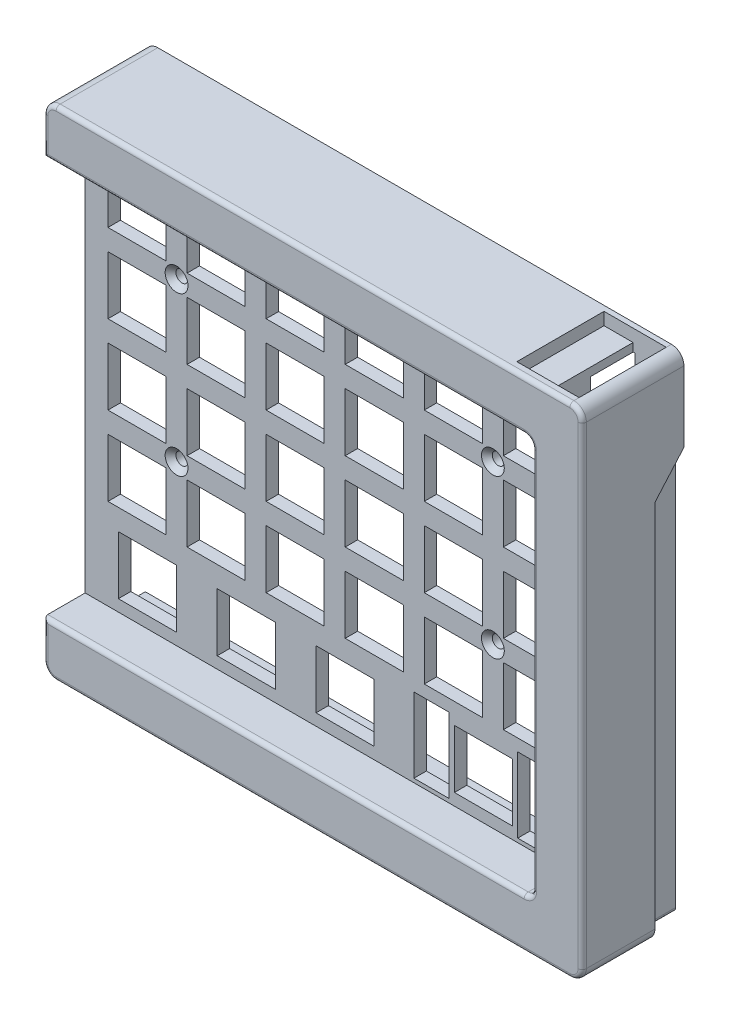
from build123d import *

# Parameters (mm, degrees)
MAIN_EXTRUSION_DEPTH                                 = 24.5
FRONT_CAVE_DEPTH                                     = 10
SKETCH2_W                                            = 14
SKETCH2_H                                            = 14
SKETCH2_W_2                                          = 8.5
SKETCH2_H_2                                          = 18
KEY_CUTOUTS_DEPTH                                    = 3
CUT_EXTRUDE1_DEPTH                                   = 11.5
CSK_FOR_M2_5_COUNTERSUNK_FLAT_HEAD_SCREW_D           = 2.9
CSK_FOR_M2_5_COUNTERSUNK_FLAT_HEAD_SCREW_CSINK_D     = 5.5
CSK_FOR_M2_5_COUNTERSUNK_FLAT_HEAD_SCREW_CSINK_ANGLE = 90
CUT_EXTRUDE2_DEPTH                                   = 2
CUT_EXTRUDE3_DEPTH                                   = 2
FILLET1_R                                            = 1
SKETCH9_W                                            = 8
SKETCH9_H                                            = 21
CUT_EXTRUDE4_DEPTH                                   = 41
SKETCH10_W                                           = 6
SKETCH10_H                                           = 10
CUT_EXTRUDE5_DEPTH                                   = 10.75
CUT_EXTRUDE6_DEPTH                                   = 1.5
SKETCH13_W                                           = 3.2
SKETCH13_H                                           = 60
CUT_EXTRUDE8_DEPTH                                   = 7
SKETCH15_W                                           = 7
SKETCH15_H                                           = 21
CUT_EXTRUDE9_DEPTH                                   = 3


with BuildPart() as part:
    # Sketch1 → Main Extrusion (new body)
    with BuildSketch(Plane.XY):
        with BuildLine():
            Line((-61.875, -60), (61.875, -60))
            ThreePointArc((61.875, -60), (63.996320344, -59.121320344), (64.875, -57))
            Line((64.875, -57), (64.875, 57))
            ThreePointArc((64.875, 57), (63.996320344, 59.121320344), (61.875, 60))
            Line((61.875, 60), (-61.875, 60))
            ThreePointArc((-61.875, 60), (-63.996320344, 59.121320344), (-64.875, 57))
            Line((-64.875, 57), (-64.875, -57))
            ThreePointArc((-64.875, -57), (-63.996320344, -59.121320344), (-61.875, -60))
        make_face()
    extrude(amount=MAIN_EXTRUSION_DEPTH)

    # Sketch3 → Front Cave (cut)
    with BuildSketch(Plane.XY.offset(24.5)):
        with BuildLine():
            Line((-64.875, 48), (50.875, 48))
            ThreePointArc((50.875, 48), (52.289213562, 47.414213562), (52.875, 46))
            Line((52.875, 46), (52.875, -46))
            ThreePointArc((52.875, -46), (52.289213562, -47.414213562), (50.875, -48))
            Line((50.875, -48), (-64.875, -48))
            Line((-64.875, -48), (-64.875, 48))
        make_face()
    extrude(amount=-FRONT_CAVE_DEPTH, mode=Mode.SUBTRACT)

    # Sketch2 → Key Cutouts (cut)
    with BuildSketch(Plane.XY.offset(14.5)):
        with Locations((-52.375, -0.1)):
            Rectangle(SKETCH2_W, SKETCH2_H)
        with Locations((-52.375, 38)):
            Rectangle(SKETCH2_W, SKETCH2_H)
        with Locations((-33.325, 38)):
            Rectangle(SKETCH2_W, SKETCH2_H)
        with Locations((-14.275, 38)):
            Rectangle(SKETCH2_W, SKETCH2_H)
        with Locations((4.775, 38)):
            Rectangle(SKETCH2_W, SKETCH2_H)
        with Locations((23.825, 38)):
            Rectangle(SKETCH2_W, SKETCH2_H)
        with Locations((42.875, 38)):
            Rectangle(SKETCH2_W, SKETCH2_H)
        with Locations((18.584400006, -38.05)):
            Rectangle(SKETCH2_W_2, SKETCH2_H_2)
        with Locations((-52.375, 18.95)):
            Rectangle(SKETCH2_W, SKETCH2_H)
        with Locations((-33.325, 18.95)):
            Rectangle(SKETCH2_W, SKETCH2_H)
        with Locations((-14.275, 18.95)):
            Rectangle(SKETCH2_W, SKETCH2_H)
        with Locations((4.775, 18.95)):
            Rectangle(SKETCH2_W, SKETCH2_H)
        with Locations((23.825, 18.95)):
            Rectangle(SKETCH2_W, SKETCH2_H)
        with Locations((42.875, 18.95)):
            Rectangle(SKETCH2_W, SKETCH2_H)
        with Locations((-33.325, -0.1)):
            Rectangle(SKETCH2_W, SKETCH2_H)
        with Locations((-14.275, -0.1)):
            Rectangle(SKETCH2_W, SKETCH2_H)
        with Locations((4.775, -0.1)):
            Rectangle(SKETCH2_W, SKETCH2_H)
        with Locations((23.825, -0.1)):
            Rectangle(SKETCH2_W, SKETCH2_H)
        with Locations((42.875, -0.1)):
            Rectangle(SKETCH2_W, SKETCH2_H)
        with Locations((-52.375, -19.15)):
            Rectangle(SKETCH2_W, SKETCH2_H)
        with Locations((-33.325, -19.15)):
            Rectangle(SKETCH2_W, SKETCH2_H)
        with Locations((-14.275, -19.15)):
            Rectangle(SKETCH2_W, SKETCH2_H)
        with Locations((4.775, -19.15)):
            Rectangle(SKETCH2_W, SKETCH2_H)
        with Locations((23.825, -19.15)):
            Rectangle(SKETCH2_W, SKETCH2_H)
        with Locations((42.875, -19.15)):
            Rectangle(SKETCH2_W, SKETCH2_H)
        with Locations((-26.063, -38.2)):
            Rectangle(SKETCH2_W, SKETCH2_H)
        with Locations((-49.875, -38.2)):
            Rectangle(SKETCH2_W, SKETCH2_H)
        with Locations((-2.251, -38.2)):
            Rectangle(SKETCH2_W, SKETCH2_H)
        with Locations((31.084, -38.15)):
            Rectangle(SKETCH2_W, SKETCH2_H)
        with Locations((43.583599994, -38.05)):
            Rectangle(SKETCH2_W_2, SKETCH2_H_2)
    extrude(amount=-KEY_CUTOUTS_DEPTH, mode=Mode.SUBTRACT)

    # Sketch4 → Cut-Extrude1 (cut)
    with BuildSketch(Plane.XY):
        Polygon((-64.875, 55), (54.375, 55), (54.375, 17.5), (59.875, 17.5), (59.875, -55), (-64.875, -55), align=None)
    extrude(amount=CUT_EXTRUDE1_DEPTH, mode=Mode.SUBTRACT)

    # CSK for M2.5 Countersunk Flat Head Screw1 (through all)
    with Locations(Plane(origin=(-42.85, 28.475, 14.5), x_dir=(1, 0, 0), z_dir=(0, 0, 1))):
        with Locations((0, 0), (76.2, 0), (76.2, -38.1), (0, -38.1)):
            CounterSinkHole(CSK_FOR_M2_5_COUNTERSUNK_FLAT_HEAD_SCREW_D / 2, CSK_FOR_M2_5_COUNTERSUNK_FLAT_HEAD_SCREW_CSINK_D / 2, counter_sink_angle=CSK_FOR_M2_5_COUNTERSUNK_FLAT_HEAD_SCREW_CSINK_ANGLE)

    # Sketch6 → Cut-Extrude2 (cut)
    with BuildSketch(Plane.XZ.offset(60)):
        Polygon((-44.875, 0), (-36.875, 7), (64.875, 7), (64.875, 0), align=None)
    extrude(amount=-CUT_EXTRUDE2_DEPTH, mode=Mode.SUBTRACT)

    # Sketch8 → Cut-Extrude3 (cut)
    with BuildSketch(Plane(origin=(64.875, 0, 0), x_dir=(0, 0, -1), z_dir=(1, 0, 0))):
        Polygon((0, -60), (-7, -60), (-7, 32), (0, 40), align=None)
    extrude(amount=-CUT_EXTRUDE3_DEPTH, mode=Mode.SUBTRACT)

    # Fillet1
    fillet1_edges = [part.edges().sort_by_distance(p)[0] for p in [
        (63.996320344, 59.121320344, 24.5),
        (0, 60, 24.5),
        (-63.996320344, 59.121320344, 24.5),
        (-64.875, 52.5, 24.5),
        (-64.875, -52.5, 24.5),
        (-63.996320344, -59.121320344, 24.5),
        (0, -60, 24.5),
        (-7, -48, 24.5),
        (52.289213562, -47.414213562, 24.5),
        (52.875, 0, 24.5),
        (52.289213562, 47.414213562, 24.5),
        (-7, 48, 24.5),
        (63.996320344, -59.121320344, 24.5),
        (62.875, -58, 3.5),
        (64.875, 0, 24.5),
    ]]
    fillet(fillet1_edges, radius=FILLET1_R)

    # Sketch9 → Cut-Extrude4 (cut)
    with BuildSketch(Plane(origin=(0, 60, 0), x_dir=(1, 0, 0), z_dir=(0, 1, 0))):
        with Locations((57.875, -11.75)):
            Rectangle(SKETCH9_W, SKETCH9_H)
    extrude(amount=-CUT_EXTRUDE4_DEPTH, mode=Mode.SUBTRACT)

    # Sketch10 → Cut-Extrude5 (cut)
    with BuildSketch(Plane(origin=(0, 0, 11.5), x_dir=(-1, 0, 0), z_dir=(0, 0, -1))):
        with Locations((-56.875, 12.5)):
            Rectangle(SKETCH10_W, SKETCH10_H)
    extrude(amount=-CUT_EXTRUDE5_DEPTH, mode=Mode.SUBTRACT)

    # Sketch11 → Cut-Extrude6 (cut)
    with BuildSketch(Plane(origin=(0, 19, 0), x_dir=(1, 0, 0), z_dir=(0, 1, 0))):
        with BuildLine():
            Line((59.875, -6.25), (59.875, -17.25))
            ThreePointArc((59.875, -17.25), (57.875, -19.25), (55.875, -17.25))
            Line((55.875, -17.25), (55.875, -6.25))
            ThreePointArc((55.875, -6.25), (57.875, -4.25), (59.875, -6.25))
        make_face()
    extrude(amount=-CUT_EXTRUDE6_DEPTH, mode=Mode.SUBTRACT)

    # Sketch13 → Cut-Extrude8 (cut)
    with BuildSketch(Plane(origin=(0, 0, 11.5), x_dir=(-1, 0, 0), z_dir=(0, 0, -1))):
        with Locations((-58.275, -25)):
            Rectangle(SKETCH13_W, SKETCH13_H)
    extrude(amount=-CUT_EXTRUDE8_DEPTH, mode=Mode.SUBTRACT)

    # Sketch15 → Cut-Extrude9 (cut)
    with BuildSketch(Plane(origin=(0, 60, 0), x_dir=(1, 0, 0), z_dir=(0, 1, 0))):
        with Locations((50.375, -11.75)):
            Rectangle(SKETCH15_W, SKETCH15_H)
    extrude(amount=-CUT_EXTRUDE9_DEPTH, mode=Mode.SUBTRACT)


solid = part.part
